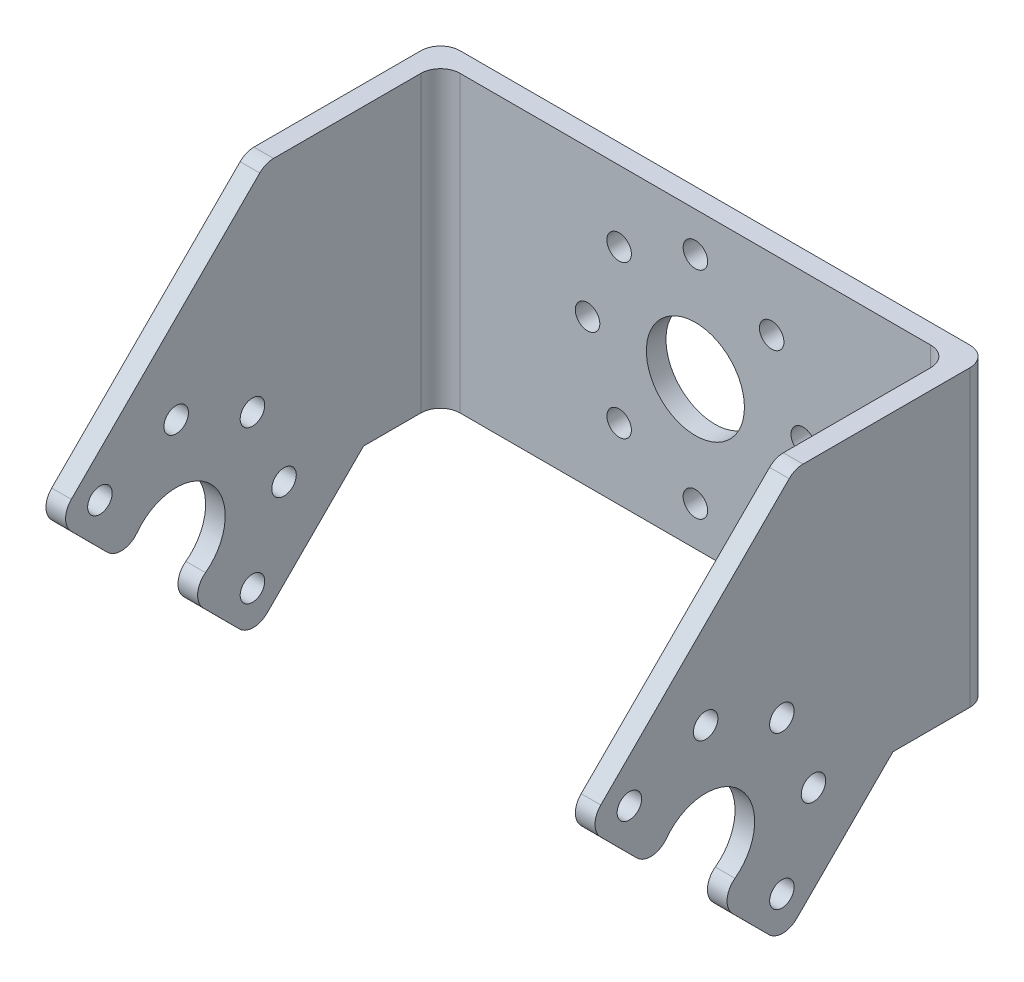
from build123d import *

# Parameters (mm, degrees)
ESBO_O1_W                 = 56
ESBO_O1_H                 = 30
RESSALTO_EXTRUS_O1_DEPTH  = 2
RESSALTO_EXTRUS_O2_DEPTH  = 2
ESBO_O3_R                 = 5
CORTE_EXTRUS_O1_DEPTH     = 2
FILETE1_R                 = 2
ESBO_O4_R                 = 1.25
CORTE_EXTRUS_O2_DEPTH     = 2
PADR_OCIRCULAR1_COUNT     = 5
PADR_OCIRCULAR1_ANGLE     = 180
ESPELHAR3_COPY_1_SKETCH_R = 1.25
ESPELHAR3_COPY_1_DEPTH    = 2
ESPELHAR3_COPY_2_SKETCH_R = 1.25
ESPELHAR3_COPY_2_DEPTH    = 2
ESPELHAR3_COPY_3_SKETCH_R = 1.25
ESPELHAR3_COPY_3_DEPTH    = 2
ESPELHAR3_COPY_4_SKETCH_R = 1.25
ESPELHAR3_COPY_4_DEPTH    = 2
FILETE1_OF_ESPELHAR3_R    = 2
FILETE3_R                 = 2
ESBO_O5_R                 = 5
CORTE_EXTRUS_O3_DEPTH     = 2
ESBO_O6_R                 = 1.25
CORTE_EXTRUS_O4_DEPTH     = 2
PADR_OCIRCULAR2_COUNT     = 8


with BuildPart() as part:
    # Esboço1 → Ressalto-extrusão1 (new body)
    with BuildSketch(Plane.XY):
        Rectangle(ESBO_O1_W, ESBO_O1_H)
    extrude(amount=-RESSALTO_EXTRUS_O1_DEPTH)

    # Esboço2 → Ressalto-extrusão2 (add)
    with BuildSketch(Plane(origin=(28, 0, 0), x_dir=(0, 0, -1), z_dir=(1, 0, 0))):
        with BuildLine():
            Line((0, 15), (-17.021572875, 15))
            ThreePointArc((-17.021572875, 15), (-17.78693974, 14.847759065), (-18.435786438, 14.414213562))
            Line((-18.435786438, 14.414213562), (-37.651095085, -4.801095085))
            ThreePointArc((-37.651095085, -4.801095085), (-38.236880968, -6.21381893), (-37.653200295, -7.627413862))
            Line((-37.653200295, -7.627413862), (-20.507208242, -24.82456756))
            ThreePointArc((-20.507208242, -24.82456756), (-19.092379188, -25.412461791), (-17.676675908, -24.826675908))
            Line((-17.676675908, -24.826675908), (-7.85, -15))
            Line((-7.85, -15), (0, -15))
            Line((0, -15), (0, 15))
        make_face()
    ressalto_extrus_o2 = extrude(amount=-RESSALTO_EXTRUS_O2_DEPTH)

    # Esboço3 → Corte-extrusão1 (cut)
    with BuildSketch(Plane(origin=(28, 0, 0), x_dir=(0, 0, -1), z_dir=(1, 0, 0))):
        with Locations((-26.955270066, -14.108290294)):
            Circle(ESBO_O3_R)
    corte_extrus_o1 = extrude(amount=-CORTE_EXTRUS_O1_DEPTH, mode=Mode.SUBTRACT)

    # Filete1
    filete1_edges = [part.edges().sort_by_distance(p)[0] for p in [
        (27, -19.05908566, 26.255537796),
        (27, -13.393810572, 31.903958653),
    ]]
    fillet(filete1_edges, radius=FILETE1_R)

    # Esboço4 → Corte-extrusão2 (cut)
    with BuildSketch(Plane(origin=(28, 0, 0), x_dir=(0, 0, -1), z_dir=(1, 0, 0))):
        with Locations((-34.733444659, -6.330115701)):
            Circle(ESBO_O4_R)
    corte_extrus_o2 = extrude(amount=-CORTE_EXTRUS_O2_DEPTH, mode=Mode.SUBTRACT)

    # PadrãoCircular1: Corte-extrusão2 ×5 about axis
    padr_ocircular1_axis = Axis((0, -14.108290294, 26.955270066), (-1, 0, 0))
    for i in range(1, PADR_OCIRCULAR1_COUNT):
        add(corte_extrus_o2.rotate(padr_ocircular1_axis, i * PADR_OCIRCULAR1_ANGLE / (PADR_OCIRCULAR1_COUNT - 1)), mode=Mode.SUBTRACT)

    # Espelhar3: Ressalto-extrusão2, Corte-extrusão1, Corte-extrusão2 across plane
    add(ressalto_extrus_o2.mirror(Plane(origin=(0, 0, 0), x_dir=(0, 0, 1), z_dir=(1, 0, 0))))
    add(corte_extrus_o1.mirror(Plane(origin=(0, 0, 0), x_dir=(0, 0, 1), z_dir=(1, 0, 0))), mode=Mode.SUBTRACT)
    add(corte_extrus_o2.mirror(Plane(origin=(0, 0, 0), x_dir=(0, 0, 1), z_dir=(1, 0, 0))), mode=Mode.SUBTRACT)

    # Espelhar3 copy 1 sketch → Espelhar3 copy 1 (cut)
    with BuildSketch(Plane(origin=(-28, -23.192476809, -2.081051924), x_dir=(0, -0.7071067811865488, -0.7071067811865462), z_dir=(-1, 0, 0))):
        with Locations((-34.733444659, 6.330115701)):
            Circle(ESPELHAR3_COPY_1_SKETCH_R)
    extrude(amount=-ESPELHAR3_COPY_1_DEPTH, mode=Mode.SUBTRACT)

    # Espelhar3 copy 2 sketch → Espelhar3 copy 2 (cut)
    with BuildSketch(Plane(origin=(-28, -41.063560361, 12.846979772), x_dir=(0, -1, 0), z_dir=(-1, 0, 0))):
        with Locations((-34.733444659, 6.330115701)):
            Circle(ESPELHAR3_COPY_2_SKETCH_R)
    extrude(amount=-ESPELHAR3_COPY_2_DEPTH, mode=Mode.SUBTRACT)

    # Espelhar3 copy 3 sketch → Espelhar3 copy 3 (cut)
    with BuildSketch(Plane(origin=(-28, -43.144612285, 36.039456581), x_dir=(0, -0.7071067811865441, 0.7071067811865509), z_dir=(-1, 0, 0))):
        with Locations((-34.733444659, 6.330115701)):
            Circle(ESPELHAR3_COPY_3_SKETCH_R)
    extrude(amount=-ESPELHAR3_COPY_3_DEPTH, mode=Mode.SUBTRACT)

    # Espelhar3 copy 4 sketch → Espelhar3 copy 4 (cut)
    with BuildSketch(Plane(origin=(-28, -28.216580589, 53.910540133), x_dir=(0, 0, 1), z_dir=(-1, 0, 0))):
        with Locations((-34.733444659, 6.330115701)):
            Circle(ESPELHAR3_COPY_4_SKETCH_R)
    extrude(amount=-ESPELHAR3_COPY_4_DEPTH, mode=Mode.SUBTRACT)

    # Filete1 of Espelhar3
    filete1_of_espelhar3_edges = [part.edges().sort_by_distance(p)[0] for p in [
        (-27, -19.05908566, 26.255537796),
        (-27, -13.393810572, 31.903958653),
    ]]
    fillet(filete1_of_espelhar3_edges, radius=FILETE1_OF_ESPELHAR3_R)

    # Filete3
    filete3_edges = [part.edges().sort_by_distance(p)[0] for p in [
        (-28, 0, -2),
        (26, 0, 0),
        (28, 0, -2),
        (-26, 0, 0),
    ]]
    fillet(filete3_edges, radius=FILETE3_R)

    # Esboço5 → Corte-extrusão3 (cut)
    with BuildSketch(Plane.XY):
        Circle(ESBO_O5_R)
    corte_extrus_o3 = extrude(amount=-CORTE_EXTRUS_O3_DEPTH, mode=Mode.SUBTRACT)

    # Esboço6 → Corte-extrusão4 (cut)
    with BuildSketch(Plane.XY):
        with Locations((0, 11)):
            Circle(ESBO_O6_R)
    corte_extrus_o4 = extrude(amount=-CORTE_EXTRUS_O4_DEPTH, mode=Mode.SUBTRACT)

    # PadrãoCircular2: Corte-extrusão3, Corte-extrusão4 ×8 about axis
    padr_ocircular2_axis = Axis((0, 0, 0), (0, 0, 1))
    add([corte_extrus_o3.rotate(padr_ocircular2_axis, i * 360 / PADR_OCIRCULAR2_COUNT) for i in range(1, PADR_OCIRCULAR2_COUNT)], mode=Mode.SUBTRACT)
    add([corte_extrus_o4.rotate(padr_ocircular2_axis, i * 360 / PADR_OCIRCULAR2_COUNT) for i in range(1, PADR_OCIRCULAR2_COUNT)], mode=Mode.SUBTRACT)


solid = part.part
